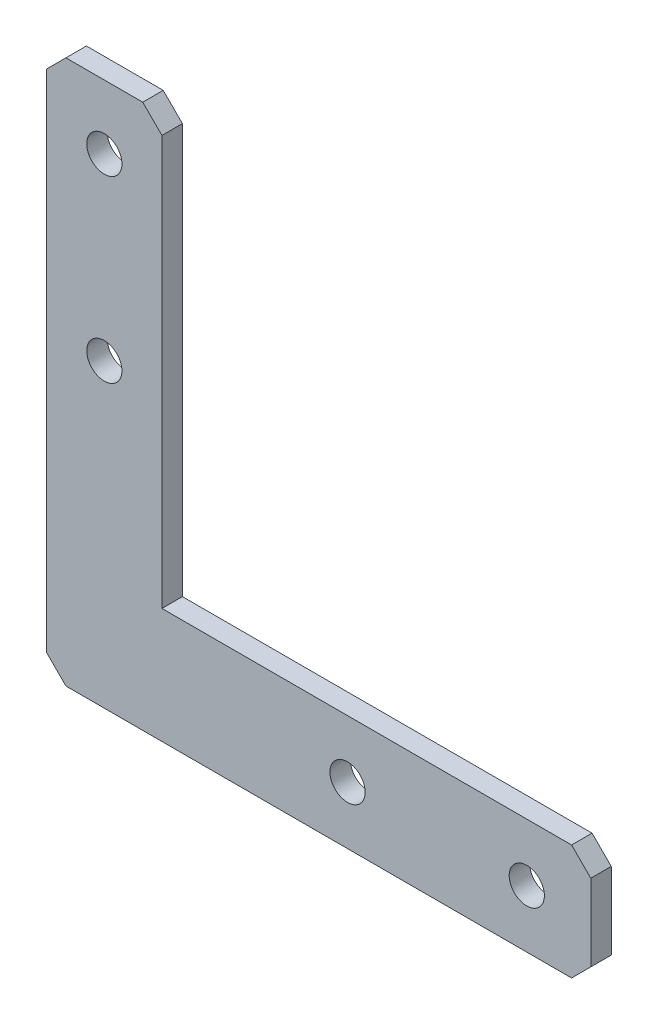
from build123d import *

# Parameters (mm, degrees)
SKETCH1_R           = 2.75
BOSS_EXTRUDE1_DEPTH = 3.2


with BuildPart() as part:
    # Sketch1 → Boss-Extrude1 (new body)
    with BuildSketch(Plane.XY):
        Polygon((0, 82), (0, 3), (3, 0), (82, 0), (85, 3), (85, 15), (82, 18), (18, 18), (18, 82), (15, 85), (3, 85), align=None)
        with Locations((75, 9)):
            Circle(SKETCH1_R, mode=Mode.SUBTRACT)
        with Locations((47, 9)):
            Circle(SKETCH1_R, mode=Mode.SUBTRACT)
        with Locations((9, 47)):
            Circle(SKETCH1_R, mode=Mode.SUBTRACT)
        with Locations((9, 75)):
            Circle(SKETCH1_R, mode=Mode.SUBTRACT)
    extrude(amount=-BOSS_EXTRUDE1_DEPTH)


solid = part.part
